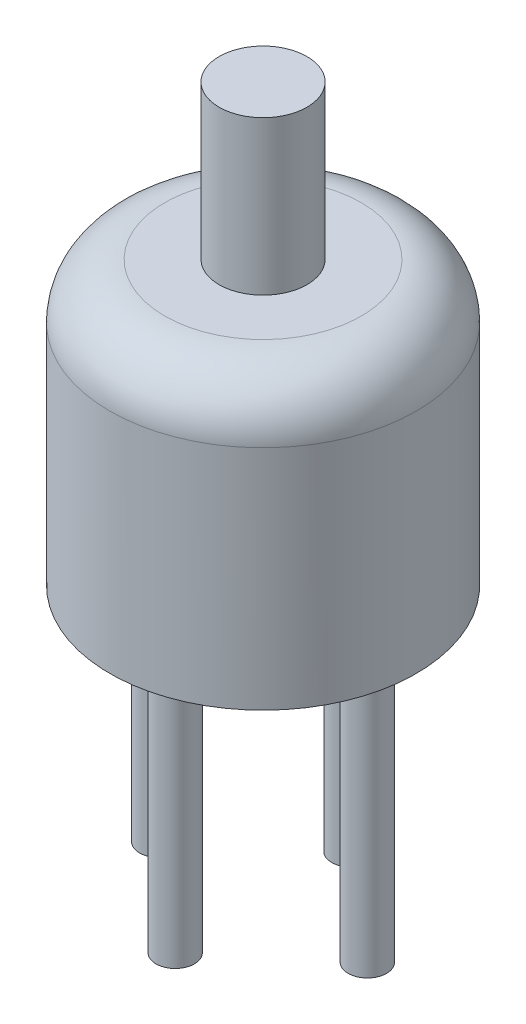
from build123d import *

# Parameters (mm, degrees)
SKETCH1_R           = 13.95
BOSS_EXTRUDE1_DEPTH = 25.7
FILLET1_R           = 5
SKETCH2_R           = 4
BOSS_EXTRUDE2_DEPTH = 14
BOSS_EXTRUDE3_DEPTH = 25


with BuildPart() as part:
    # Sketch1 → Boss-Extrude1 (new body)
    with BuildSketch(Plane(origin=(0, 0, 0), x_dir=(1, 0, 0), z_dir=(0, 1, 0))):
        with Locations(Location((0, 0, 0), (0, 0, 90))):
            Circle(SKETCH1_R)
    extrude(amount=BOSS_EXTRUDE1_DEPTH)

    # Fillet1
    fillet1_edges = [part.edges().sort_by_distance(p)[0] for p in [
        (0, 25.7, 13.95),
    ]]
    fillet(fillet1_edges, radius=FILLET1_R)

    # Sketch2 → Boss-Extrude2 (add)
    with BuildSketch(Plane(origin=(0, 25.7, 0), x_dir=(1, 0, 0), z_dir=(0, 1, 0))):
        with Locations(Location((0, 0, 0), (0, 0, 270))):
            Circle(SKETCH2_R)
    extrude(amount=BOSS_EXTRUDE2_DEPTH)

    # Sketch3 → Boss-Extrude3 (add)
    with BuildSketch(Plane.XZ):
        with BuildLine():
            ThreePointArc((0, 9.75), (-1.75, 8), (0, 6.25))
            Line((0, 6.25), (0, 9.75))
        make_face()
        with BuildLine():
            Line((0, 9.75), (0, 6.25))
            ThreePointArc((0, 6.25), (1.237436867, 6.762563133), (1.75, 8))
            ThreePointArc((1.75, 8), (1.237436867, 9.237436867), (0, 9.75))
        make_face()
        with BuildLine():
            ThreePointArc((-11.25, 0), (-9.5, -1.75), (-7.75, 0))
            Line((-7.75, 0), (-11.25, 0))
        make_face()
        with BuildLine():
            Line((-11.25, 0), (-7.75, 0))
            ThreePointArc((-7.75, 0), (-9.5, 1.75), (-11.25, 0))
        make_face()
        with BuildLine():
            ThreePointArc((1.75, -8), (1.237436867, -6.762563133), (0, -6.25))
            Line((0, -6.25), (0, -9.75))
            ThreePointArc((0, -9.75), (1.237436867, -9.237436867), (1.75, -8))
        make_face()
        with BuildLine():
            Line((0, -9.75), (0, -6.25))
            ThreePointArc((0, -6.25), (-1.75, -8), (0, -9.75))
        make_face()
        with BuildLine():
            ThreePointArc((7.75, 0), (9.5, -1.75), (11.25, 0))
            Line((11.25, 0), (7.75, 0))
        make_face()
        with BuildLine():
            Line((7.75, 0), (11.25, 0))
            ThreePointArc((11.25, 0), (9.5, 1.75), (7.75, 0))
        make_face()
    extrude(amount=BOSS_EXTRUDE3_DEPTH)


solid = part.part
